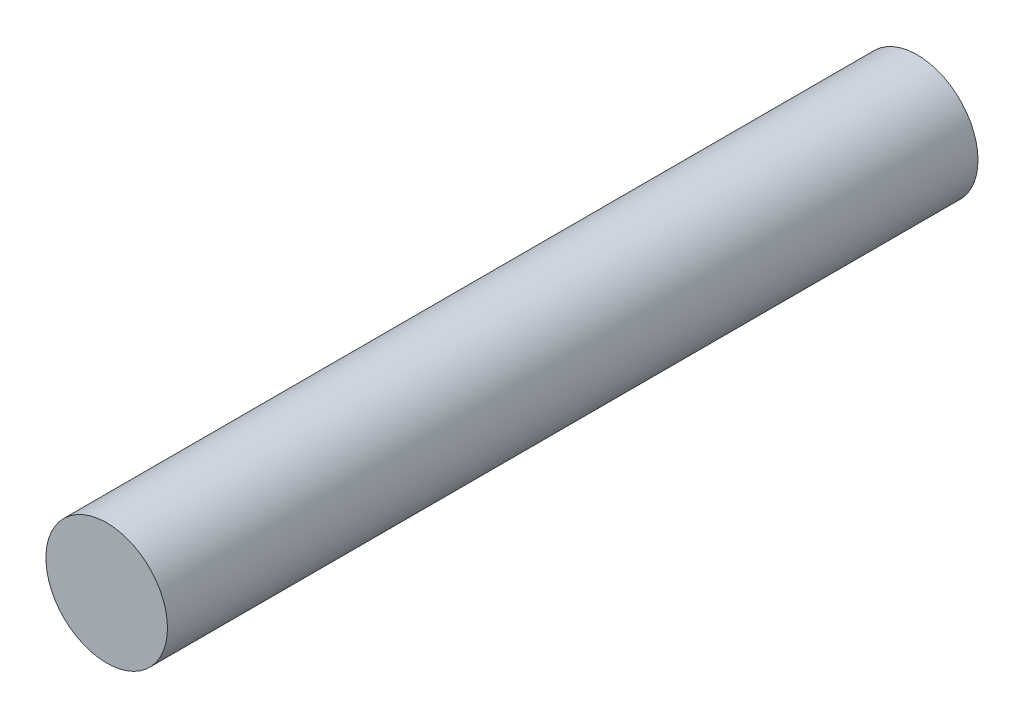
from build123d import *

# Parameters (mm, degrees)
SKETCH2_R           = 3.75
BOSS_EXTRUDE1_DEPTH = 50


with BuildPart() as part:
    # Sketch2 → Boss-Extrude1 (new body)
    with BuildSketch(Plane.XY):
        Circle(SKETCH2_R)
    extrude(amount=BOSS_EXTRUDE1_DEPTH)


solid = part.part
